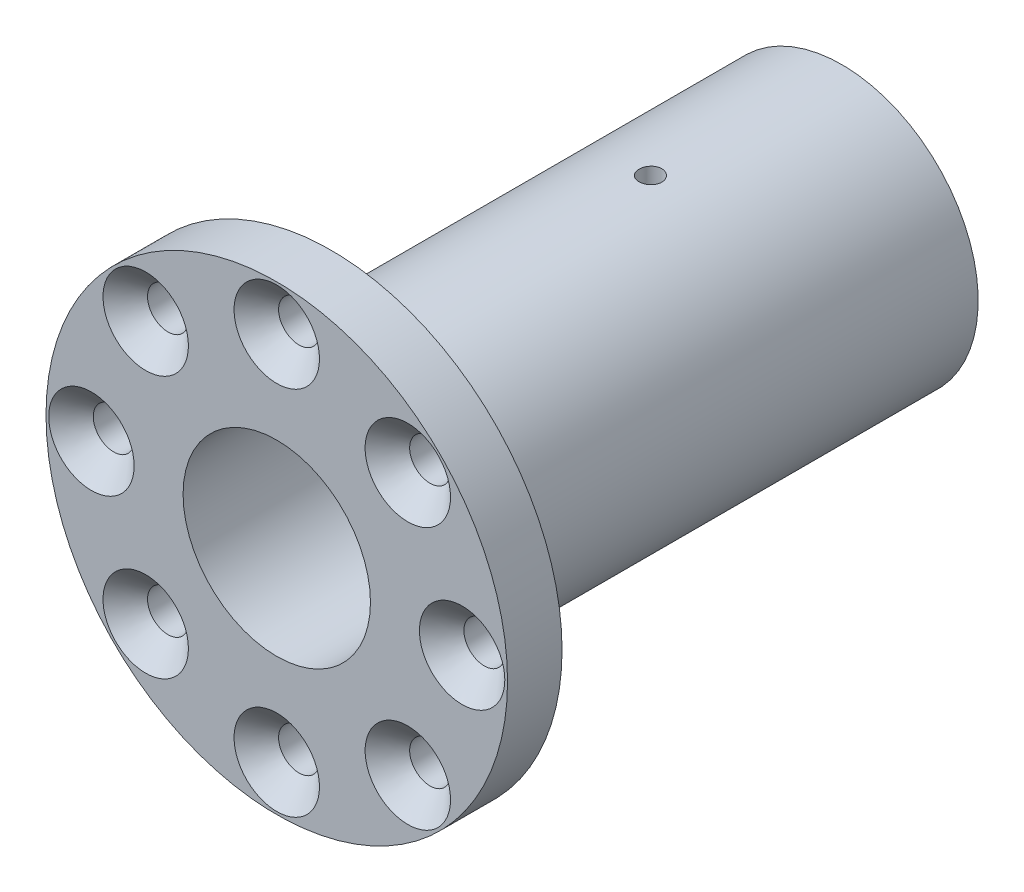
from build123d import *

# Parameters (mm, degrees)
SKETCH1_W                                         = 25.4
SKETCH1_H                                         = 6
SKETCH2_R                                         = 15
BOSS_EXTRUDE1_DEPTH                               = 56.2
CUT_EXTRUDE1_DEPTH                                = 72.827292863
SKETCH4_W                                         = 7.0104
SKETCH4_H                                         = 65.418639441
F_2_CLEARANCE_HOLE1_D                             = 2.5
F_2_CLEARANCE_HOLE1_DEPTH                         = 12
SKETCH7_W                                         = 1.25
SKETCH7_H                                         = 16.341500105
CSK_FOR_8_FLAT_HEAD_MACHINE_SCREW_100_D           = 4.5
CSK_FOR_8_FLAT_HEAD_MACHINE_SCREW_100_DEPTH       = 62.2
CSK_FOR_8_FLAT_HEAD_MACHINE_SCREW_100_CSINK_D     = 9.4
CSK_FOR_8_FLAT_HEAD_MACHINE_SCREW_100_CSINK_ANGLE = 90
SKETCH11_R                                        = 10.3124
CUT_EXTRUDE2_DEPTH                                = 38.1


with BuildPart() as part:
    # Sketch1 → Revolve1 (revolve)
    with BuildSketch(Plane.XZ, mode=Mode.PRIVATE) as revolve1_sk:
        with Locations((12.7, 58.54)):
            Rectangle(SKETCH1_W, SKETCH1_H)
    revolve(revolve1_sk.sketch.rotate(Axis((0, 0, 61.54), (0, 0, -1)), 180), axis=Axis((0, 0, 61.54), (0, 0, -1)))

    # Sketch2 → Boss-Extrude1 (add)
    with BuildSketch(Plane(origin=(0, 0, 55.54), x_dir=(-1, 0, 0), z_dir=(0, 0, -1))):
        Circle(SKETCH2_R)
    extrude(amount=BOSS_EXTRUDE1_DEPTH)

    # Sketch3 → Cut-Extrude1 (cut, through all)
    with BuildSketch(Plane(origin=(0, 0, -0.66), x_dir=(-1, 0, 0), z_dir=(0, 0, -1))):
        with BuildLine():
            Line((2.5, 9.058499895), (-2.5, 9.058499895))
            Line((-2.5, 9.058499895), (-2.5, 6.538348415))
            ThreePointArc((-2.5, 6.538348415), (0, 7), (2.5, 6.538348415))
            Line((2.5, 6.538348415), (2.5, 9.058499895))
        make_face()
    extrude(amount=-CUT_EXTRUDE1_DEPTH, mode=Mode.SUBTRACT)

    # Sketch4 → Cut-Revolve1 (revolve, cut)
    with BuildSketch(Plane.XZ):
        with Locations((3.5052, 28.83068028)):
            Rectangle(SKETCH4_W, SKETCH4_H)
    revolve(axis=Axis((0, 0, 61.54), (0, 0, -1)), mode=Mode.SUBTRACT)

    # #2 Clearance Hole1
    with Locations(Plane(origin=(0, 0, -0.66), x_dir=(-1, 0, 0), z_dir=(0, 0, -1))):
        with Locations((-11.5, 0), (-5.75, -9.959292144), (5.75, -9.959292144), (11.5, 0), (5.75, 9.959292144), (-5.75, 9.959292144)):
            Hole(F_2_CLEARANCE_HOLE1_D / 2, depth=F_2_CLEARANCE_HOLE1_DEPTH)

    # Sketch7 → #2 Clearance Hole2 (revolve, cut)
    with BuildSketch(Plane(origin=(0, 9.058499895, 20.422), x_dir=(0, 0, -1), z_dir=(1, 0, 0))):
        with Locations((0.625, 8.170750053)):
            Rectangle(SKETCH7_W, SKETCH7_H)
    revolve(axis=Axis((0, 2.708499895, 20.422), (0, 1, 0)), mode=Mode.SUBTRACT)

    # CSK for #8 Flat Head Machine Screw (100)1
    with Locations(Plane.XY.offset(61.54)):
        with Locations((0, 20.4), (14.424978336, 14.424978336), (20.4, 0), (14.424978336, -14.424978336), (0, -20.4), (-14.424978336, -14.424978336), (-20.4, 0), (-14.424978336, 14.424978336)):
            CounterSinkHole(CSK_FOR_8_FLAT_HEAD_MACHINE_SCREW_100_D / 2, CSK_FOR_8_FLAT_HEAD_MACHINE_SCREW_100_CSINK_D / 2, depth=CSK_FOR_8_FLAT_HEAD_MACHINE_SCREW_100_DEPTH, counter_sink_angle=CSK_FOR_8_FLAT_HEAD_MACHINE_SCREW_100_CSINK_ANGLE)

    # Sketch11 → Cut-Extrude2 (cut)
    with BuildSketch(Plane.XY.offset(61.54)):
        Circle(SKETCH11_R)
    extrude(amount=-CUT_EXTRUDE2_DEPTH, mode=Mode.SUBTRACT)


solid = part.part
